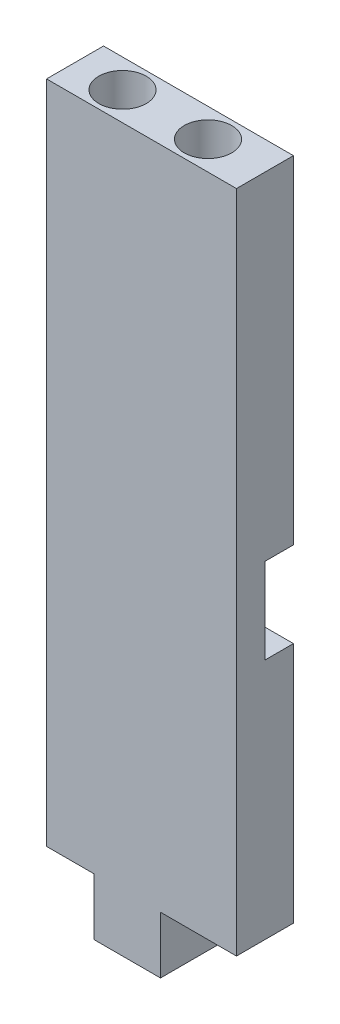
from build123d import *

# Parameters (mm, degrees)
ESQUISSE1_W                = 20
ESQUISSE1_H                = 70
BOSS_EXTRU_1_DEPTH         = 6
ESQUISSE2_W                = 8
ESQUISSE2_H                = 9
ESQUISSE2_W_2              = 7
ENL_V_MAT_EXTRU_1_DEPTH    = 3
ESQUISSE3_W                = 7
ESQUISSE3_H                = 6
BOSS_EXTRU_2_DEPTH         = 6
ESQUISSE4_R                = 2.5
ENL_V_MAT_EXTRU_2_DEPTH    = 10
R_P_TITION_LIN_AIRE1_COUNT = 2
R_P_TITION_LIN_AIRE1_PITCH = 9


with BuildPart() as part:
    # Esquisse1 → Boss.-Extru.1 (new body)
    with BuildSketch(Plane.XY):
        with Locations((10, 35)):
            Rectangle(ESQUISSE1_W, ESQUISSE1_H)
    extrude(amount=BOSS_EXTRU_1_DEPTH)

    # Esquisse2 → Enlèv. mat.-Extru.1 (cut)
    with BuildSketch(Plane(origin=(0, 0, 0), x_dir=(-1, 0, 0), z_dir=(0, 0, -1))):
        with Locations((-4, 30)):
            Rectangle(ESQUISSE2_W, ESQUISSE2_H)
        with Locations((-16.5, 30)):
            Rectangle(ESQUISSE2_W_2, ESQUISSE2_H)
    extrude(amount=-ENL_V_MAT_EXTRU_1_DEPTH, mode=Mode.SUBTRACT)

    # Esquisse3 → Boss.-Extru.2 (add)
    with BuildSketch(Plane.XZ):
        with Locations((8.5, 3)):
            Rectangle(ESQUISSE3_W, ESQUISSE3_H)
    extrude(amount=BOSS_EXTRU_2_DEPTH)

    # Esquisse4 → Enlèv. mat.-Extru.2 (cut)
    with BuildSketch(Plane(origin=(0, 70, 0), x_dir=(1, 0, 0), z_dir=(0, 1, 0))):
        with Locations(Location((5, -3, 0), (0, 0, 270))):
            Circle(ESQUISSE4_R)
    enl_v_mat_extru_2 = extrude(amount=-ENL_V_MAT_EXTRU_2_DEPTH, mode=Mode.SUBTRACT)

    # Répétition linéaire1: Enlèv. mat.-Extru.2 ×2
    with Locations(*[(i * R_P_TITION_LIN_AIRE1_PITCH, 0, 0) for i in range(1, R_P_TITION_LIN_AIRE1_COUNT)]):
        add(enl_v_mat_extru_2, mode=Mode.SUBTRACT)


solid = part.part
